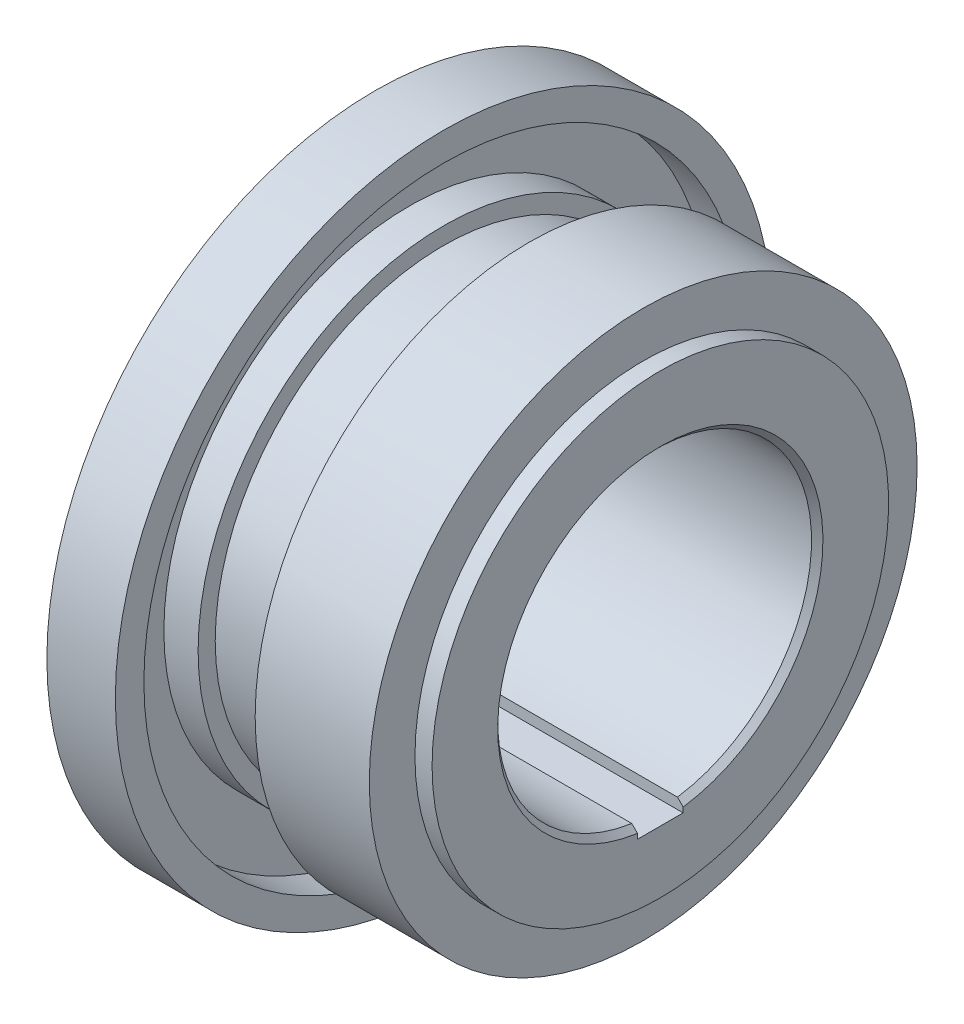
from build123d import *

# Parameters (mm, degrees)
CHAMFER_1_SIZE      = 1
SKETCH_3_W          = 20
SKETCH_3_H          = 8.011692653
SKETCH_4_W          = 8
SKETCH_4_H          = 6.987786138
CUT_EXTRUDE_1_DEPTH = 96.45941546


with BuildPart() as part:
    # 草图1 → 旋转1 (revolve)
    with BuildSketch(Plane.XY, mode=Mode.PRIVATE) as revolve_1_sk:
        Polygon((0, 27.5), (0, 57.5), (12, 57.5), (12, 52.5), (6, 52.5), (6, 43), (12, 43), (12, 40), (50, 40), (50, 27.5), align=None)
    revolve(revolve_1_sk.sketch.rotate(Axis((0, 0, 0), (1, 0, 0)), 90), axis=Axis((0, 0, 0), (1, 0, 0)))

    # 倒角1
    chamfer_1_edges = [part.edges().sort_by_distance(p)[0] for p in [
        (0, 0, -27.5),
        (50, 0, -27.5),
    ]]
    chamfer(chamfer_1_edges, length=CHAMFER_1_SIZE)

    # 草图3 → 旋转2 (revolve)
    with BuildSketch(Plane.XY, mode=Mode.PRIVATE) as revolve_2_sk:
        with Locations((37, 43.994153674)):
            Rectangle(SKETCH_3_W, SKETCH_3_H)
    revolve(revolve_2_sk.sketch.rotate(Axis((27, 0, 0), (1, 0, 0)), 90), axis=Axis((27, 0, 0), (1, 0, 0)))

    # 草图4 → 切除-拉伸1 (cut, through all)
    with BuildSketch(Plane.ZY):
        with Locations((0, -25.606106931)):
            Rectangle(SKETCH_4_W, SKETCH_4_H)
    extrude(amount=-CUT_EXTRUDE_1_DEPTH, mode=Mode.SUBTRACT)


solid = part.part
